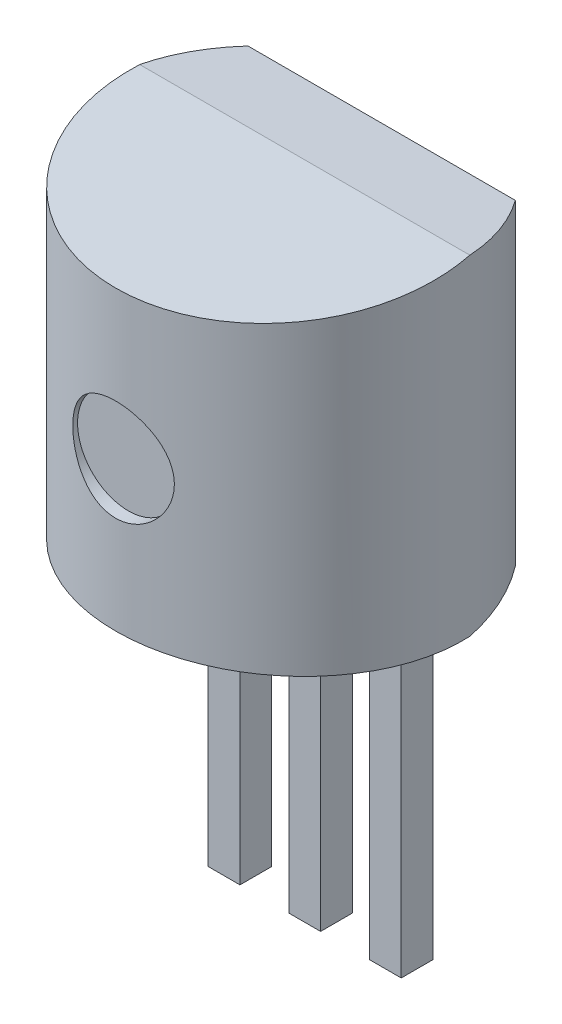
from build123d import *

# Parameters (mm, degrees)
BOSS_EXTRUDE1_DEPTH             = 2.6
SKETCH5_W                       = 11.826356456
SKETCH5_H                       = 5.621169426
CUT_EXTRUDE2_DEPTH              = 7.632050589
SKETCH6_W                       = 11.690711404
SKETCH6_H                       = 7.254613366
CUT_EXTRUDE3_DEPTH              = 5.2
SKETCH7_W                       = 0.5
SKETCH7_H                       = 0.5
BOSS_EXTRUDE2_DEPTH             = 12.7
BOSS_EXTRUDE2_DIRECTION_2_REACH = 8.542
SKETCH8_R                       = 0.8
CUT_EXTRUDE4_DEPTH              = 0.2
SKETCH10_W                      = 6.769382977
SKETCH10_H                      = 8.778669798
CUT_EXTRUDE5_DEPTH              = 17.078911904


with BuildPart() as part:
    # Sketch2 → Boss-Extrude1 (new, symmetric)
    with BuildSketch(Plane(origin=(0, 0, 0), x_dir=(1, 0, 0), z_dir=(0, 1, 0))):
        with BuildLine():
            Line((-2.105447518, 1.212026432), (2.105447518, 1.212026432))
            ThreePointArc((2.105447518, 1.212026432), (0, -2.977973568), (-2.105447518, 1.212026432))
        make_face()
    extrude(amount=BOSS_EXTRUDE1_DEPTH, both=True)

    # Sketch5 → Cut-Extrude2 (cut, through all)
    with BuildSketch(Plane(origin=(0, 2.580250079, -0.225742631), x_dir=(1, 0, 0), z_dir=(0, 0.9961946980917455, -0.08715574274765836))):
        with Locations((0.924694538, -0.744658901)):
            Rectangle(SKETCH5_W, SKETCH5_H)
    cut_extrude2 = extrude(amount=CUT_EXTRUDE2_DEPTH, mode=Mode.SUBTRACT)

    # Sketch6 → Cut-Extrude3 (cut)
    with BuildSketch(Plane(origin=(0, 2.580250079, 0.225742631), x_dir=(1, 0, 0), z_dir=(0, 0.9961946980917467, 0.08715574274764504))):
        with Locations((0.257342704, -2.465539164)):
            Rectangle(SKETCH6_W, SKETCH6_H)
    cut_extrude3 = extrude(amount=CUT_EXTRUDE3_DEPTH, mode=Mode.SUBTRACT)

    # Mirror1: Cut-Extrude2, Cut-Extrude3 across plane
    add(cut_extrude2.mirror(Plane.ZX), mode=Mode.SUBTRACT)
    add(cut_extrude3.mirror(Plane.ZX), mode=Mode.SUBTRACT)

    # Sketch7 → Boss-Extrude2 (add)
    with BuildSketch(Plane(origin=(0, -2.6, 0), x_dir=(-1, 0, 0), z_dir=(0, -1, 0))):
        with Locations((-1.27, 0.25)):
            Rectangle(SKETCH7_W, SKETCH7_H)
        with Locations((0, 0.25)):
            Rectangle(SKETCH7_W, SKETCH7_H)
        with Locations((1.27, 0.25)):
            Rectangle(SKETCH7_W, SKETCH7_H)
    extrude(amount=BOSS_EXTRUDE2_DEPTH)

    # Sketch7 → Boss-Extrude2 direction 2 (add, up to next)
    with BuildSketch(Plane(origin=(0, -2.6, 0), x_dir=(-1, 0, 0), z_dir=(0, -1, 0)), mode=Mode.PRIVATE) as boss_extrude2_direction_2_sk1:
        with Locations((-1.27, 0.25)):
            Rectangle(SKETCH7_W, SKETCH7_H)
    boss_extrude2_direction_2_tool1 = extrude(boss_extrude2_direction_2_sk1.sketch, amount=-BOSS_EXTRUDE2_DIRECTION_2_REACH, mode=Mode.PRIVATE) - part.part
    # Sketch7 → Boss-Extrude2 direction 2 (add, up to next)
    with BuildSketch(Plane(origin=(0, -2.6, 0), x_dir=(-1, 0, 0), z_dir=(0, -1, 0)), mode=Mode.PRIVATE) as boss_extrude2_direction_2_sk2:
        with Locations((0, 0.25)):
            Rectangle(SKETCH7_W, SKETCH7_H)
    boss_extrude2_direction_2_tool2 = extrude(boss_extrude2_direction_2_sk2.sketch, amount=-BOSS_EXTRUDE2_DIRECTION_2_REACH, mode=Mode.PRIVATE) - part.part
    # Sketch7 → Boss-Extrude2 direction 2 (add, up to next)
    with BuildSketch(Plane(origin=(0, -2.6, 0), x_dir=(-1, 0, 0), z_dir=(0, -1, 0)), mode=Mode.PRIVATE) as boss_extrude2_direction_2_sk3:
        with Locations((1.27, 0.25)):
            Rectangle(SKETCH7_W, SKETCH7_H)
    boss_extrude2_direction_2_tool3 = extrude(boss_extrude2_direction_2_sk3.sketch, amount=-BOSS_EXTRUDE2_DIRECTION_2_REACH, mode=Mode.PRIVATE) - part.part
    add(boss_extrude2_direction_2_tool1.solids().sort_by_distance((1.27, -2.6, -0.25))[0])
    add(boss_extrude2_direction_2_tool2.solids().sort_by_distance((0, -2.6, -0.25))[0])
    add(boss_extrude2_direction_2_tool3.solids().sort_by_distance((-1.27, -2.6, -0.25))[0])

    # Sketch8 → Cut-Extrude4 (cut)
    with BuildSketch(Plane.XY.offset(2.977973568)):
        Circle(SKETCH8_R)
    extrude(amount=-CUT_EXTRUDE4_DEPTH, mode=Mode.SUBTRACT)

    # Sketch10 → Cut-Extrude5 (cut, through all)
    with BuildSketch(Plane(origin=(0, 0, -1.212026432), x_dir=(-1, 0, 0), z_dir=(0, 0, -1))):
        with Locations((0.550161867, -12.189334899)):
            Rectangle(SKETCH10_W, SKETCH10_H)
    extrude(amount=-CUT_EXTRUDE5_DEPTH, mode=Mode.SUBTRACT)


solid = part.part
